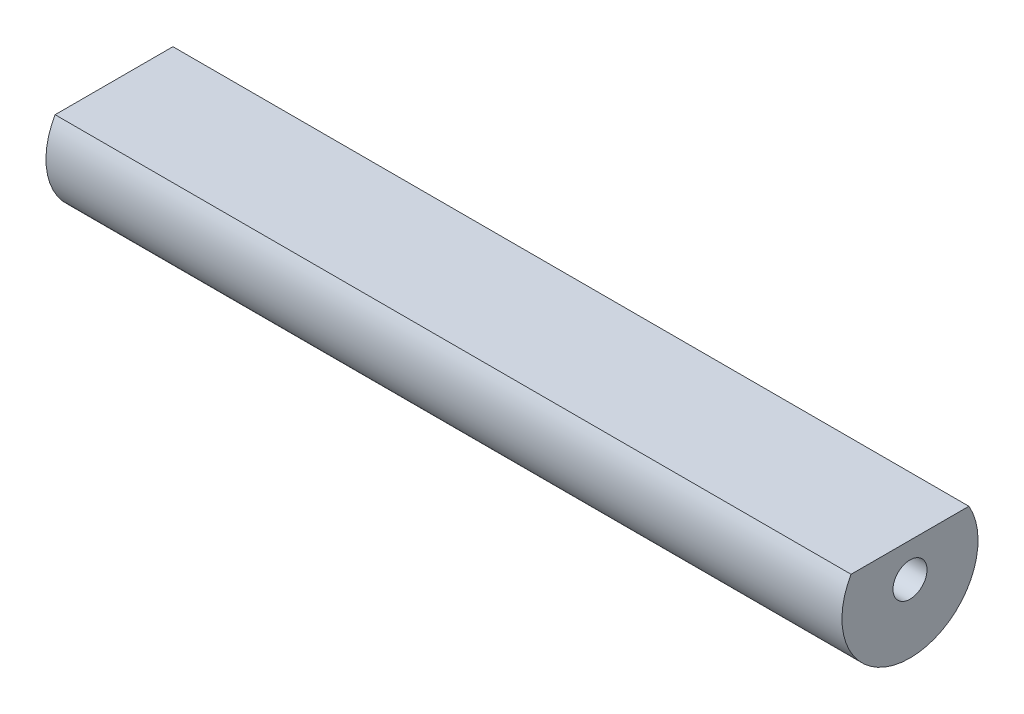
from build123d import *

# Parameters (mm, degrees)
ESQUISSE1_W             = 117
ESQUISSE1_H             = 10
ENL_V_MAT_EXTRU_1_REACH = 119.852
ESQUISSE2_R             = 2.5
ENL_V_MAT_EXTRU_2_REACH = 119.852
ESQUISSE3_W             = 20
ESQUISSE3_H             = 5


with BuildPart() as part:
    # Esquisse1 → Révolution1 (revolve)
    with BuildSketch(Plane.XY):
        with Locations((-58.5, 5)):
            Rectangle(ESQUISSE1_W, ESQUISSE1_H)
    revolve(axis=Axis((0, 0, 0), (-1, 0, 0)))

    # Esquisse2 → Enlèv. mat.-Extru.1 (cut, up to next)
    with BuildSketch(Plane(origin=(0, 0, 0), x_dir=(0, 0, -1), z_dir=(1, 0, 0)), mode=Mode.PRIVATE) as enl_v_mat_extru_1_sk1:
        with Locations(Location((0, 0, 0), (0, 0, 90))):
            Circle(ESQUISSE2_R)
    enl_v_mat_extru_1_tool1 = extrude(enl_v_mat_extru_1_sk1.sketch, amount=-ENL_V_MAT_EXTRU_1_REACH, mode=Mode.PRIVATE) & part.part
    add(enl_v_mat_extru_1_tool1.solids().sort_by_distance((0, 0, 0))[0], mode=Mode.SUBTRACT)

    # Esquisse3 → Enlèv. mat.-Extru.2 (cut, up to next)
    with BuildSketch(Plane(origin=(0, 0, 0), x_dir=(0, 0, -1), z_dir=(1, 0, 0)), mode=Mode.PRIVATE) as enl_v_mat_extru_2_sk1:
        with Locations((0, 7.5)):
            Rectangle(ESQUISSE3_W, ESQUISSE3_H)
    enl_v_mat_extru_2_tool1 = extrude(enl_v_mat_extru_2_sk1.sketch, amount=-ENL_V_MAT_EXTRU_2_REACH, mode=Mode.PRIVATE) & part.part
    add(enl_v_mat_extru_2_tool1.solids().sort_by_distance((0, 7.5, 0))[0], mode=Mode.SUBTRACT)


solid = part.part
